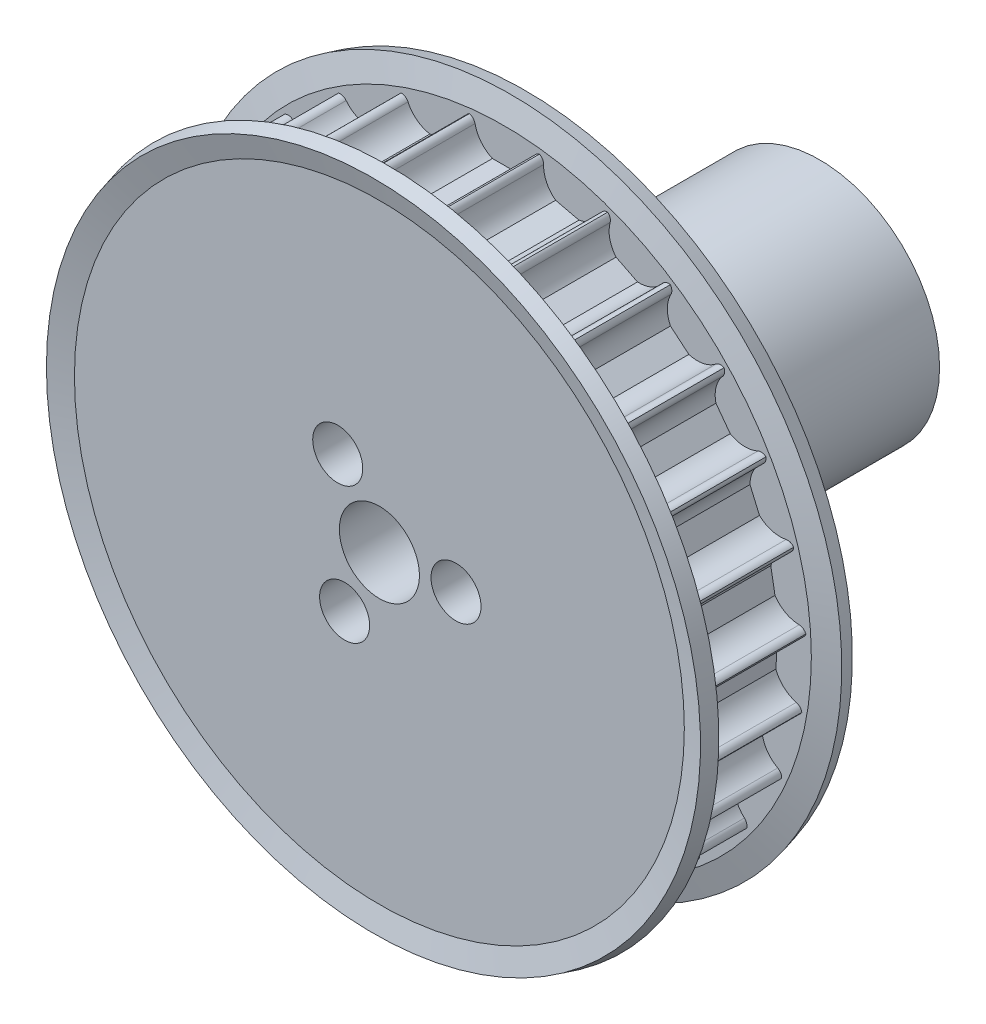
from build123d import *

# Parameters (mm, degrees)
CUT_EXTRUDE1_DEPTH = 63.112800613
CIRPATTERN1_COUNT  = 27
SKETCH4_R          = 2.5
CUT_EXTRUDE2_DEPTH = 65.630326609


with BuildPart() as part:
    # Sketch1 → Revolve1 (revolve)
    with BuildSketch(Plane(origin=(0, 0, 0), x_dir=(0, 0, -1), z_dir=(1, 0, 0)), mode=Mode.PRIVATE) as revolve1_sk:
        Polygon((0, 4), (0, 31), (14, 31), (14, 12), (44, 12), (44, 4), align=None)
    revolve(revolve1_sk.sketch.rotate(Axis((0, 0, -88.99), (0, 0, 1)), 90), axis=Axis((0, 0, -88.99), (0, 0, 1)))

    # Sketch2 → Cut-Extrude1 (cut, through all)
    with BuildSketch(Plane.XY):
        with BuildLine():
            Line((3.674234614, 30), (3.75, 30))
            Line((3.75, 30), (3.75, 32))
            Line((3.75, 32), (-3.75, 32))
            Line((-3.75, 32), (-3.75, 30))
            Line((-3.75, 30), (-3.674234614, 30))
            ThreePointArc((-3.674234614, 30), (-3.199892965, 29.830947502), (-2.939387691, 29.4))
            ThreePointArc((-2.939387691, 29.4), (-2.331759211, 28.112435701), (-1.198957881, 27.25))
            Line((-1.198957881, 27.25), (1.198957881, 27.25))
            ThreePointArc((1.198957881, 27.25), (2.331759211, 28.112435701), (2.939387691, 29.4))
            ThreePointArc((2.939387691, 29.4), (3.199892965, 29.830947502), (3.674234614, 30))
        make_face()
    cut_extrude1 = extrude(amount=-CUT_EXTRUDE1_DEPTH, mode=Mode.SUBTRACT)

    # CirPattern1: Cut-Extrude1 ×27 about axis
    cirpattern1_axis = Axis((0, 0, 0), (0, 0, 1))
    for i in range(1, CIRPATTERN1_COUNT):
        add(cut_extrude1.rotate(cirpattern1_axis, i * 360 / CIRPATTERN1_COUNT), mode=Mode.SUBTRACT)

    # Sketch3 → Revolve3 (revolve)
    with BuildSketch(Plane(origin=(0, 0, 0), x_dir=(0, 0, -1), z_dir=(1, 0, 0)), mode=Mode.PRIVATE) as revolve3_sk:
        Polygon((0, 30.482995966), (0, 27.241490762), (1.5, 27.241490762), (1.5, 30.680474712), (0.856921938, 33.080474712), (-0.591966801, 32.692246144), align=None)
        Polygon((14.591966801, 32.692246144), (13.143078062, 33.080474712), (12.5, 30.680474712), (12.5, 27.241490762), (14, 27.241490762), (14, 30.482995966), align=None)
    revolve(revolve3_sk.sketch.rotate(Axis((0, 0, -88.99), (0, 0, 1)), 90), axis=Axis((0, 0, -88.99), (0, 0, 1)))

    # Sketch4 → Cut-Extrude2 (cut, through all)
    with BuildSketch(Plane(origin=(0, 0, -44), x_dir=(-1, 0, 0), z_dir=(0, 0, -1))):
        with Locations((-7.66, 0.399007468)):
            Circle(SKETCH4_R)
        with Locations((4.164865292, 6.428802151)):
            Circle(SKETCH4_R)
        with Locations((3.474388022, -6.826728929)):
            Circle(SKETCH4_R)
    extrude(amount=-CUT_EXTRUDE2_DEPTH, mode=Mode.SUBTRACT)


solid = part.part
